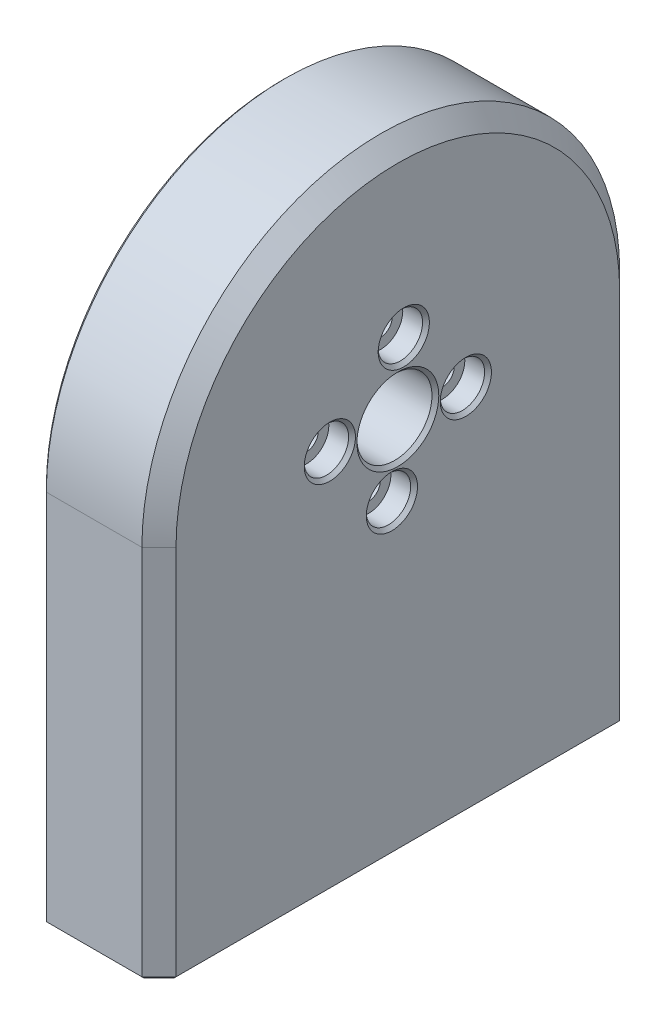
from build123d import *

# Parameters (mm, degrees)
SKETCH1_R                                           = 35
SKETCH1_R_2                                         = 5.5
SKETCH1_R_3                                         = 17
BOSS_EXTRUDE1_DEPTH                                 = 17
BOSS_EXTRUDE2_START                                 = -0.5
SKETCH1_3_R                                         = 17
SKETCH1_3_R_2                                       = 5.5
BOSS_EXTRUDE2_DEPTH                                 = 0.5
CBORE_FOR_M3_HEX_SOCKET_HEAD_CAP_SCREW1_D           = 3.4
CBORE_FOR_M3_HEX_SOCKET_HEAD_CAP_SCREW1_CBORE_D     = 6.5
CBORE_FOR_M3_HEX_SOCKET_HEAD_CAP_SCREW1_CBORE_DEPTH = 3.4
F_5_6_5_6_DIAMETER_HOLE1_D                          = 5.6
F_5_6_5_6_DIAMETER_HOLE1_DEPTH                      = 8
F_5_6_5_6_DIAMETER_HOLE1_TIP                        = 1.682409733
F_2_5MM_CHAMFER1_SIZE                               = 2.5
F_0_5MM_CHAMFER2_SIZE                               = 0.5


with BuildPart() as part:
    # Sketch1 → Boss-Extrude1 (new body)
    # profile 1 of 3: a face of its own
    with BuildSketch(Plane(origin=(0, 0, 0), x_dir=(0, 0, -1), z_dir=(1, 0, 0))):
        Circle(SKETCH1_R)
        Circle(SKETCH1_R_2, mode=Mode.SUBTRACT)
    # profile 2 of 3: a face of its own
    with BuildSketch(Plane(origin=(0, 0, 0), x_dir=(0, 0, -1), z_dir=(1, 0, 0))):
        with BuildLine():
            ThreePointArc((35, 0), (0, -35), (-35, 0))
            Line((-35, 0), (-35, -55))
            Line((-35, -55), (35, -55))
            Line((35, -55), (35, 0))
        make_face()
    # profile 3 of 3: a face of its own
    with BuildSketch(Plane(origin=(0, 0, 0), x_dir=(0, 0, -1), z_dir=(1, 0, 0))):
        Circle(SKETCH1_R_3)
        Circle(SKETCH1_R_2, mode=Mode.SUBTRACT)
    extrude(amount=BOSS_EXTRUDE1_DEPTH)

    # Sketch1<3> → Boss-Extrude2 (add)
    with BuildSketch(Plane(origin=(0, 0, 0), x_dir=(0, 0, -1), z_dir=(1, 0, 0)).offset(BOSS_EXTRUDE2_START)):
        Circle(SKETCH1_3_R)
        Circle(SKETCH1_3_R_2, mode=Mode.SUBTRACT)
    extrude(amount=BOSS_EXTRUDE2_DEPTH)

    # CBORE for M3 Hex Socket Head Cap Screw1 (through all)
    with Locations(Plane(origin=(17, 0, 0), x_dir=(0, 0, -1), z_dir=(1, 0, 0))):
        with Locations((-9.961946981, 0.871557427), (0.871557427, 9.961946981), (9.961946981, -0.871557427), (-0.871557427, -9.961946981)):
            CounterBoreHole(CBORE_FOR_M3_HEX_SOCKET_HEAD_CAP_SCREW1_D / 2, CBORE_FOR_M3_HEX_SOCKET_HEAD_CAP_SCREW1_CBORE_D / 2, CBORE_FOR_M3_HEX_SOCKET_HEAD_CAP_SCREW1_CBORE_DEPTH)

    # Ø5.6 (5.6) Diameter Hole1
    with Locations(Plane(origin=(0, -55, 0), x_dir=(-1, 0, 0), z_dir=(0, -1, 0))):
        with Locations((-8.5, -20.2), (-8.5, 21.2), (-8.5, 7.4), (-8.5, -6.4)):
            Hole(F_5_6_5_6_DIAMETER_HOLE1_D / 2, depth=F_5_6_5_6_DIAMETER_HOLE1_DEPTH)
            with Locations((0, 0, -(F_5_6_5_6_DIAMETER_HOLE1_DEPTH + F_5_6_5_6_DIAMETER_HOLE1_TIP / 2))):  # 118° drill point
                Cone(0, F_5_6_5_6_DIAMETER_HOLE1_D / 2, F_5_6_5_6_DIAMETER_HOLE1_TIP, mode=Mode.SUBTRACT)

    # 2,5mm Chamfer1
    f_2_5mm_chamfer1_edges = [part.edges().sort_by_distance(p)[0] for p in [
        (17, -27.5, 35),
        (17, -27.5, -35),
        (17, 35, 0),
    ]]
    chamfer(f_2_5mm_chamfer1_edges, length=F_2_5MM_CHAMFER1_SIZE)

    # 0,5mm Chamfer2
    f_0_5mm_chamfer2_edges = [part.edges().sort_by_distance(p)[0] for p in [
        (17, 0, 5.5),
        (17, 0.871557427, 13.211946981),
        (-0.5, 0.871557427, 8.261946981),
        (17, -9.961946981, 4.121557427),
        (-0.5, -9.961946981, -0.828442573),
        (17, -0.871557427, -6.711946981),
        (-0.5, -0.871557427, -11.661946981),
        (17, 9.961946981, 2.378442573),
        (-0.5, 9.961946981, -2.571557427),
        (5.7, -55, 20.2),
        (5.7, -55, 6.4),
        (5.7, -55, -7.4),
        (5.7, -55, -21.2),
        (0, -27.5, -35),
        (7.25, -55, -35),
        (17, -55, 0),
        (7.25, -55, 35),
        (15.75, -55, 33.75),
        (0, -55, 0),
        (15.75, -55, -33.75),
        (0, -27.5, 35),
        (0, 35, 0),
    ]]
    chamfer(f_0_5mm_chamfer2_edges, length=F_0_5MM_CHAMFER2_SIZE)


solid = part.part
